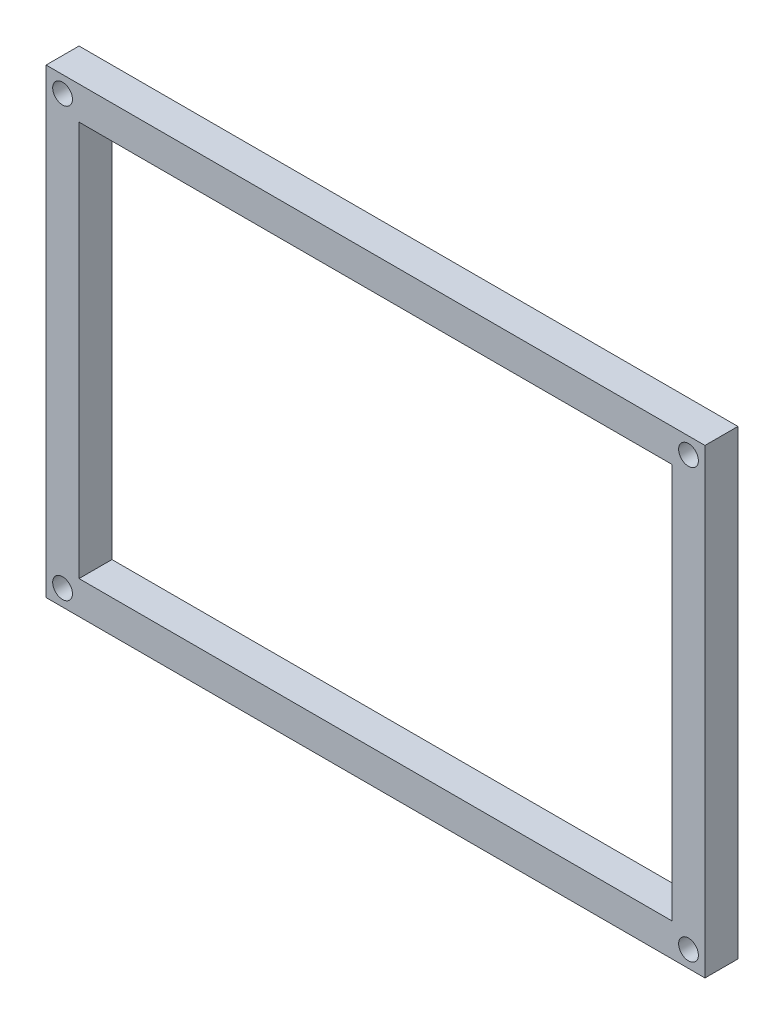
from build123d import *

# Parameters (mm, degrees)
SKETCH1_W           = 100
SKETCH1_H           = 70
SKETCH1_R           = 1.5
SKETCH1_W_2         = 90
SKETCH1_H_2         = 60
BOSS_EXTRUDE1_DEPTH = 5


with BuildPart() as part:
    # Sketch1 → Boss-Extrude1 (new body)
    with BuildSketch(Plane.XY):
        with Locations((45, 30)):
            Rectangle(SKETCH1_W, SKETCH1_H)
        with Locations((92.5, -2.5)):
            Circle(SKETCH1_R, mode=Mode.SUBTRACT)
        with Locations((92.5, 62.5)):
            Circle(SKETCH1_R, mode=Mode.SUBTRACT)
        with Locations((-2.5, 62.5)):
            Circle(SKETCH1_R, mode=Mode.SUBTRACT)
        with Locations((-2.5, -2.5)):
            Circle(SKETCH1_R, mode=Mode.SUBTRACT)
        with Locations((45, 30)):
            Rectangle(SKETCH1_W_2, SKETCH1_H_2, mode=Mode.SUBTRACT)
    extrude(amount=BOSS_EXTRUDE1_DEPTH)


solid = part.part
